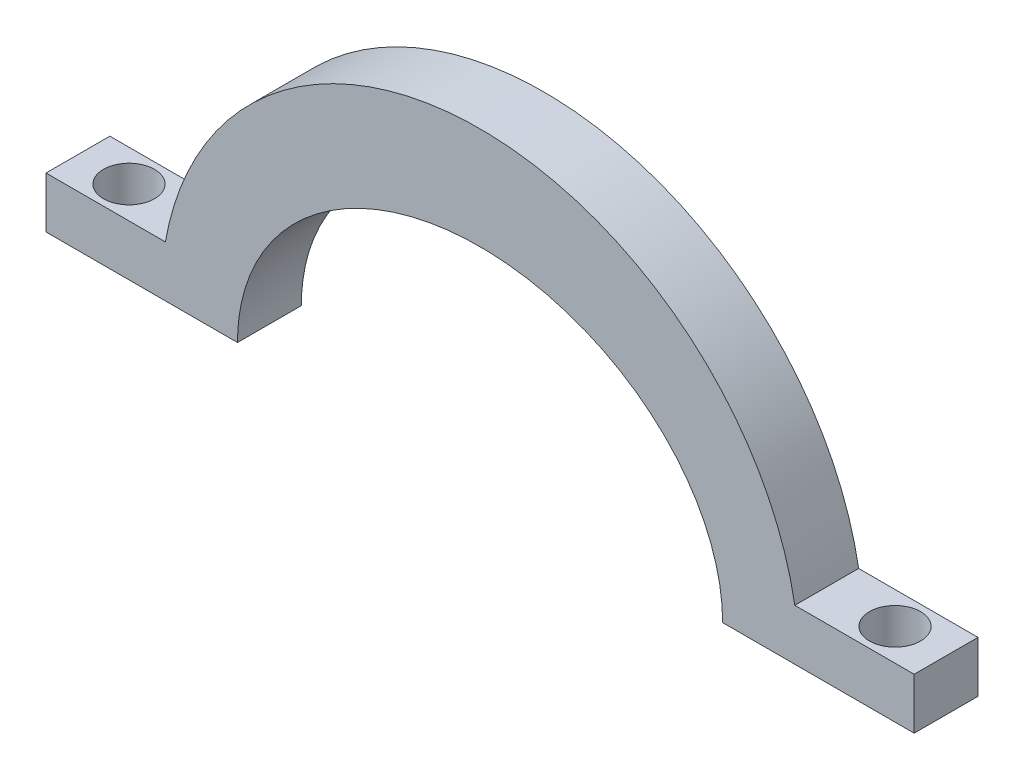
from build123d import *

# Parameters (mm, degrees)
BOSS_EXTRUDE1_DEPTH = 5
SKETCH2_W           = 15
SKETCH2_H           = 5
BOSS_EXTRUDE2_DEPTH = 4
SKETCH3_R           = 2
CUT_EXTRUDE1_DEPTH  = 42.916583981


with BuildPart() as part:
    # Sketch1 → Boss-Extrude1 (new body)
    with BuildSketch(Plane.XY):
        with BuildLine():
            add(Edge.make_bspline(
                [(19, 0), (19, 16), (0, 16), (-19, 16), (-19, 0)],
                knots=[0, 0, 0, 1.570796327, 1.570796327, 3.141592654, 3.141592654, 3.141592654], degree=2, weights=[1, 0.707106781, 1, 0.707106781, 1]))
            Line((19, 0), (25, 0))
            add(Edge.make_bspline(
                [(25, 0), (25, 24), (0, 24), (-25, 24), (-25, 0)],
                knots=[0, 0, 0, 1.570796327, 1.570796327, 3.141592654, 3.141592654, 3.141592654], degree=2, weights=[1, 0.707106781, 1, 0.707106781, 1]))
            Line((-25, 0), (-19, 0))
        make_face()
    extrude(amount=BOSS_EXTRUDE1_DEPTH)

    # Sketch2 → Boss-Extrude2 (add)
    with BuildSketch(Plane.XZ):
        with Locations((-26.5, 2.5)):
            Rectangle(SKETCH2_W, SKETCH2_H)
        with Locations((26.5, 2.5)):
            Rectangle(SKETCH2_W, SKETCH2_H)
    extrude(amount=-BOSS_EXTRUDE2_DEPTH)

    # Sketch3 → Cut-Extrude1 (cut, through all)
    with BuildSketch(Plane.XZ):
        with Locations(Location((-30, 2.5, 0), (0, 0, 270))):
            Circle(SKETCH3_R)
        with Locations(Location((30, 2.5, 0), (0, 0, 90))):
            Circle(SKETCH3_R)
    extrude(amount=-CUT_EXTRUDE1_DEPTH, mode=Mode.SUBTRACT)


solid = part.part
